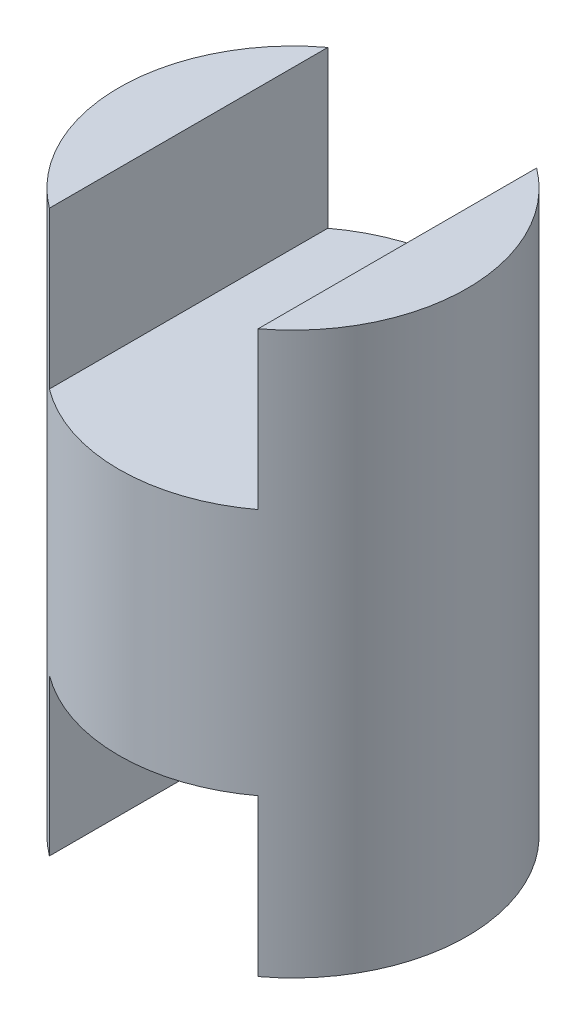
from build123d import *

# Parameters (mm, degrees)
SKETCH1_R           = 12.7
BOSS_EXTRUDE1_DEPTH = 40.9448
CUT_EXTRUDE1_START  = -11.43
CUT_EXTRUDE1_DEPTH  = 11.43
CUT_EXTRUDE2_DEPTH  = 11.43


with BuildPart() as part:
    # Sketch1 → Boss-Extrude1 (new body)
    with BuildSketch(Plane(origin=(0, 0, 0), x_dir=(1, 0, 0), z_dir=(0, 1, 0))):
        with Locations(Location((0, 0, 0), (0, 0, 270))):
            Circle(SKETCH1_R)
    extrude(amount=BOSS_EXTRUDE1_DEPTH)

    # Sketch2 → Cut-Extrude1 (cut)
    with BuildSketch(Plane(origin=(0, 40.9448, 0), x_dir=(1, 0, 0), z_dir=(0, 1, 0)).offset(CUT_EXTRUDE1_START)):
        with BuildLine():
            Line((7.62, 10.16), (7.62, -10.16))
            ThreePointArc((7.62, -10.16), (0, -12.7), (-7.62, -10.16))
            Line((-7.62, -10.16), (-7.62, 10.16))
            ThreePointArc((-7.62, 10.16), (0, 12.7), (7.62, 10.16))
        make_face()
    extrude(amount=CUT_EXTRUDE1_DEPTH, mode=Mode.SUBTRACT)

    # Sketch3 → Cut-Extrude2 (cut)
    with BuildSketch(Plane.XZ):
        with BuildLine():
            Line((-7.62, 10.16), (-7.62, -10.16))
            ThreePointArc((-7.62, -10.16), (0, -12.7), (7.62, -10.16))
            Line((7.62, -10.16), (7.62, 10.16))
            ThreePointArc((7.62, 10.16), (0, 12.7), (-7.62, 10.16))
        make_face()
    extrude(amount=-CUT_EXTRUDE2_DEPTH, mode=Mode.SUBTRACT)


solid = part.part
